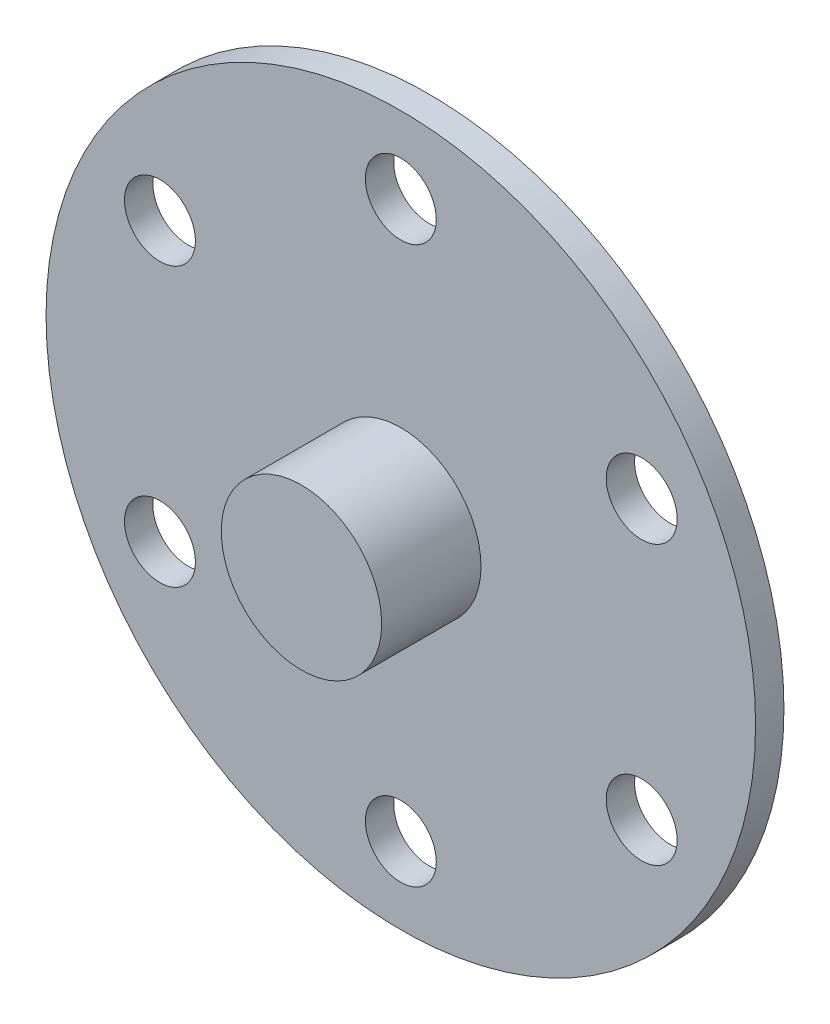
from build123d import *

# Parameters (mm, degrees)
SKETCH4_R           = 63.5
BOSS_EXTRUDE1_DEPTH = 5.08
SKETCH5_R           = 14.351
BOSS_EXTRUDE2_DEPTH = 17.78
SKETCH6_R           = 6.35
CUT_EXTRUDE1_DEPTH  = 17.78


with BuildPart() as part:
    # Sketch4 → Boss-Extrude1 (new body)
    with BuildSketch(Plane.XY):
        Circle(SKETCH4_R)
    extrude(amount=-BOSS_EXTRUDE1_DEPTH)

    # Sketch5 → Boss-Extrude2 (add)
    with BuildSketch(Plane.XY):
        Circle(SKETCH5_R)
    extrude(amount=BOSS_EXTRUDE2_DEPTH)

    # Sketch6 → Cut-Extrude1 (cut)
    with BuildSketch(Plane.XY):
        with Locations((0, 49.784)):
            Circle(SKETCH6_R)
        with Locations((43.114208702, 24.892)):
            Circle(SKETCH6_R)
        with Locations((43.114208702, -24.892)):
            Circle(SKETCH6_R)
        with Locations((0, -49.784)):
            Circle(SKETCH6_R)
        with Locations((-43.114208702, -24.892)):
            Circle(SKETCH6_R)
        with Locations((-43.114208702, 24.892)):
            Circle(SKETCH6_R)
    extrude(amount=-CUT_EXTRUDE1_DEPTH, mode=Mode.SUBTRACT)


solid = part.part
